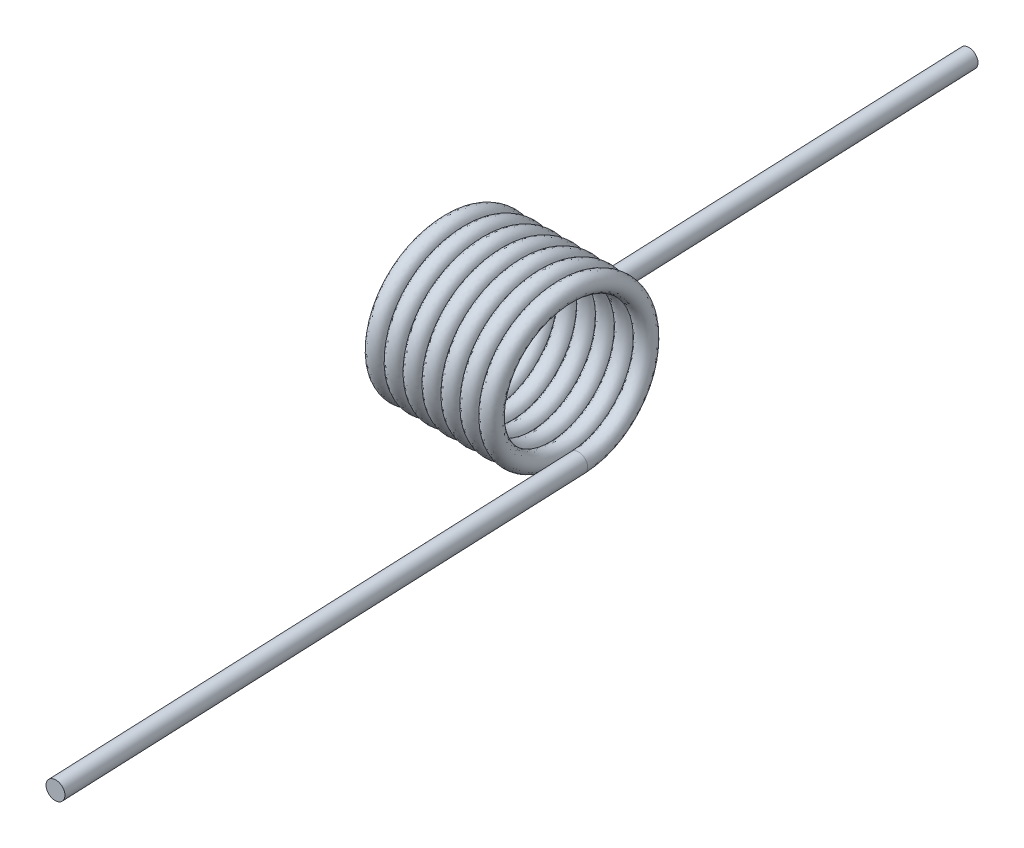
from build123d import *

# Parameters (mm, degrees)
SWEEP1_PITCH       = 0.6604
SWEEP1_HEIGHT      = 4.6228
SWEEP1_RADIUS      = 2.5273
SWEEP1_START_ANGLE = 90
SKETCH3_R          = 0.3175
SKETCH4_R          = 0.3175
EXTRUDE1_DEPTH     = 19.05
SKETCH5_R          = 0.3175
EXTRUDE2_DEPTH     = 19.05


with BuildPart() as part:
    # Sweep1: sweep along a helix
    with BuildLine() as sweep1_path:
        add(Helix(SWEEP1_PITCH, SWEEP1_HEIGHT, SWEEP1_RADIUS, center=(0, 0, 0), direction=(-1, 0, 0), lefthand=True, mode=Mode.PRIVATE).rotate(Axis((0, 0, 0), (-1, 0, 0)), SWEEP1_START_ANGLE))
    # Sketch3 → Sweep1 (sweep)
    with BuildSketch(Plane(origin=(0, -2.5273, 0), x_dir=(0.9988665677845978, -0.023236129092747772, -0.04154108890006059), z_dir=(-0.04155230782772583, 9.227644690024128e-15, -0.9991363298940691))):
        Circle(SKETCH3_R)
    sweep(path=sweep1_path.line, is_frenet=True)

    # Sketch4 → Extrude1 (add)
    with BuildSketch(Plane(origin=(0, 0, 0), x_dir=(-0.9988665677845978, 0.023236129092747804, 0.04154108890006059), z_dir=(0.04155230782772582, -9.227319429372383e-15, 0.999136329894069))):
        with Locations(Location((-0.058724669, 2.526617641, 0), (0, 0, 1.33145196))):
            Circle(SKETCH4_R)
    extrude(amount=EXTRUDE1_DEPTH)

    # Sketch5 → Extrude2 (add)
    with BuildSketch(Plane(origin=(-0.0079817, 0, -0.191922108), x_dir=(0.9978899151022226, 0.04993423865780966, -0.041500471647249175), z_dir=(-0.04155230782772582, 1.067626889672546e-13, -0.9991363298940691))):
        with Locations(Location((-4.739244301, 2.293510581, 0), (0, 0, 182.862211423))):
            Circle(SKETCH5_R)
    extrude(amount=EXTRUDE2_DEPTH)


solid = part.part
